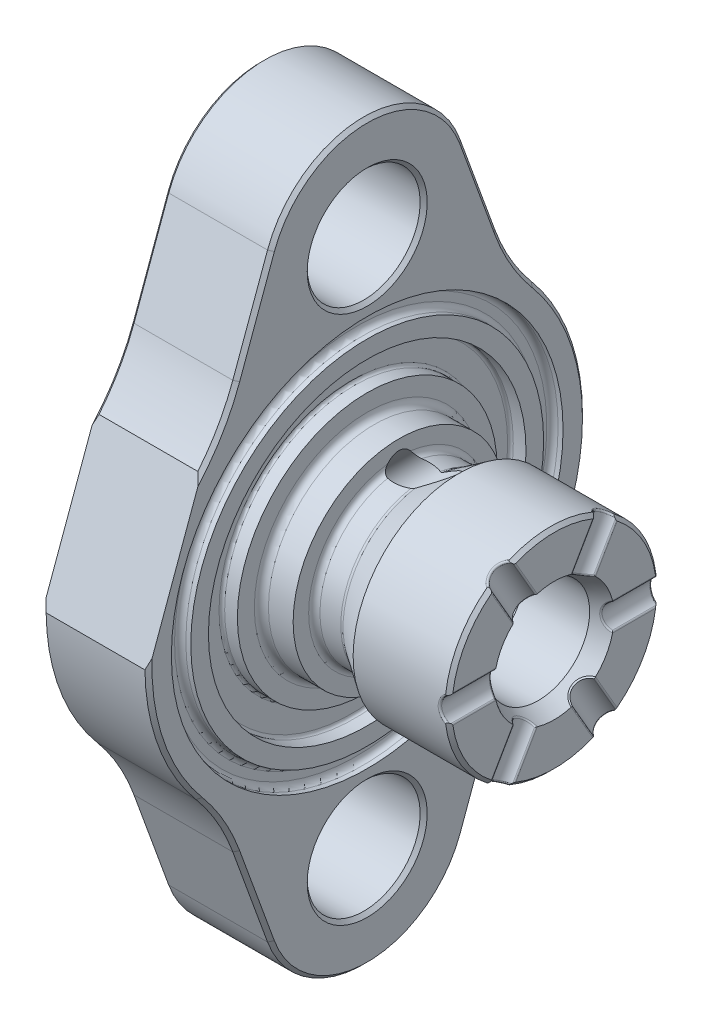
from build123d import *

# Parameters (mm, degrees)
SKETCH2_OUTSIDE_W  = 137.836
SKETCH2_OUTSIDE_H  = 137.836
CUT_EXTRUDE1_DEPTH = 86.05733360504549
SKETCH3_R          = 8
CUT_EXTRUDE2_DEPTH = 74.39788825300084
CHAMFER2_SIZE      = 0.5
CUT_EXTRUDE4_DEPTH = 74.39788825300084
CIRPATTERN1_COUNT  = 6
CUT_EXTRUDE5_DEPTH = 15
CUT_EXTRUDE6_START = -12
SKETCH10_R         = 2.5000000000000013
CUT_EXTRUDE6_DEPTH = 92.37332678519904
CIRPATTERN2_COUNT  = 2
SKETCH13_W         = 0.35897435897435903
SKETCH13_H         = 1.3461538461538485
SKETCH13_W_2       = 0.3589743589743595
SKETCH13_H_2       = 1.3461538461538463
EXTRUDE1_DEPTH     = 0.1
CHAMFER3_SIZE      = 0.5
FILLET1_R          = 0.25


with BuildPart() as part:
    # Sketch1 → Revolve1 (revolve)
    with BuildSketch(Plane.XY, mode=Mode.PRIVATE) as revolve1_sk:
        with BuildLine():
            Line((0, 0), (0, 52.5))
            Line((0, 52.5), (15, 52.5))
            Line((15, 52.5), (15.000000000000004, 27.75))
            Line((15.000000000000004, 27.75), (14.300000000000004, 27.749999999999996))
            ThreePointArc((14.300000000000004, 27.749999999999996), (13.734314575050764, 27.515685424949243), (13.500000000000002, 26.950000000000003))
            Line((13.500000000000002, 26.950000000000003), (13.500000000000002, 25.8))
            ThreePointArc((13.500000000000002, 25.8), (13.734314575050764, 25.23431457505076), (14.300000000000004, 24.999999999999996))
            Line((14.300000000000004, 24.999999999999996), (15.000000000000004, 25))
            Line((15.000000000000004, 25), (15.000000000000004, 22.5))
            Line((15.000000000000004, 22.5), (13.200000000000003, 22.500000000000004))
            ThreePointArc((13.200000000000003, 22.500000000000004), (12.917157287525379, 22.38284271247462), (12.800000000000004, 22.099999999999998))
            Line((12.800000000000004, 22.099999999999998), (12.800000000000004, 18.8))
            ThreePointArc((12.800000000000004, 18.8), (12.917157287525379, 18.51715728752538), (13.200000000000003, 18.399999999999995))
            Line((13.200000000000003, 18.399999999999995), (15.000000000000004, 18.4))
            Line((15.000000000000004, 18.4), (15.000000000000005, 15.997500000000008))
            ThreePointArc((15.000000000000005, 15.997500000000008), (15.292893218813456, 15.290393218813453), (16.00000000000001, 14.9975))
            Line((16.00000000000001, 14.9975), (19.500000000000004, 14.9975))
            Line((19.500000000000004, 14.9975), (19.499999999999996, 12.8))
            ThreePointArc((19.499999999999996, 12.8), (19.734314575050753, 12.23431457505076), (20.299999999999994, 11.999999999999998))
            Line((20.299999999999994, 11.999999999999998), (23.257947472805416, 12))
            ThreePointArc((23.257947472805416, 12), (23.489627504783442, 12.034281799365681), (23.701451515828207, 12.13418909304335))
            Line((23.701451515828207, 12.13418909304335), (28.000000000000004, 14.9975))
            Line((28.000000000000004, 14.9975), (41.5, 14.9975))
            Line((41.5, 14.9975), (41.5, 8.5))
            Line((41.5, 8.5), (39.25, 7.265))
            Line((39.25, 7.265), (29.999999999999996, 7.264999999999999))
            Line((29.999999999999996, 7.264999999999999), (29.999999999999996, 7.5))
            Line((29.999999999999996, 7.5), (28.499999999999996, 7.5))
            Line((28.499999999999996, 7.5), (27.908152290257846, 6.515))
            Line((27.908152290257846, 6.515), (13.499999999999996, 6.514999999999998))
            Line((13.499999999999996, 6.514999999999998), (13.500000000000004, 6.9))
            Line((13.500000000000004, 6.9), (11.500000000000005, 6.8999999999999995))
            Line((11.500000000000005, 6.8999999999999995), (7.354061728709797, 5e-17))
            Line((7.354061728709797, 5e-17), (0, 0))
        make_face()
    revolve(revolve1_sk.sketch.rotate(Axis((0, 0, 0), (1, 0, 0)), 90), axis=Axis((0, 0, 0), (1, 0, 0)))

    # Sketch2 outside → Cut-Extrude1 (cut, through all)
    with BuildSketch(Plane.ZY):
        Rectangle(SKETCH2_OUTSIDE_W, SKETCH2_OUTSIDE_H)
        with BuildLine():
            Line((13.6255430013957, 42.45929207822211), (18.546401412865883, 28.939344708374172))
            ThreePointArc((18.546401412865883, 28.939344708374172), (20.75479793540391, 24.2027552587924), (23.751681657864584, 19.92128556151584))
            ThreePointArc((23.751681657864584, 19.92128556151584), (31.000000000000007, 0), (23.751681657864584, -19.92128556151584))
            ThreePointArc((23.751681657864584, -19.92128556151584), (20.75479793540391, -24.2027552587924), (18.546401412865883, -28.939344708374172))
            Line((18.546401412865883, -28.939344708374172), (13.6255430013957, -42.45929207822211))
            ThreePointArc((13.6255430013957, -42.45929207822211), (8.9e-16, -52), (-13.6255430013957, -42.45929207822211))
            Line((-13.6255430013957, -42.45929207822211), (-18.546401412865883, -28.939344708374172))
            ThreePointArc((-18.546401412865883, -28.939344708374172), (-20.754797935403904, -24.20275525879241), (-23.751681657864584, -19.92128556151584))
            ThreePointArc((-23.751681657864584, -19.92128556151584), (-31.000000000000007, -3.8e-15), (-23.751681657864584, 19.92128556151584))
            ThreePointArc((-23.751681657864584, 19.92128556151584), (-20.754797935403904, 24.20275525879241), (-18.546401412865883, 28.939344708374172))
            Line((-18.546401412865883, 28.939344708374172), (-13.6255430013957, 42.45929207822211))
            ThreePointArc((-13.6255430013957, 42.45929207822211), (8.9e-16, 52), (13.6255430013957, 42.45929207822211))
        make_face(mode=Mode.SUBTRACT)
    extrude(amount=-CUT_EXTRUDE1_DEPTH, mode=Mode.SUBTRACT)

    # Sketch3 → Cut-Extrude2 (cut, through all)
    with BuildSketch(Plane.ZY):
        with Locations((0, 37.5)):
            Circle(SKETCH3_R)
    cut_extrude2 = extrude(amount=-CUT_EXTRUDE2_DEPTH, mode=Mode.SUBTRACT)

    # Mirror1: Cut-Extrude2 across plane
    add(cut_extrude2.mirror(Plane.ZX), mode=Mode.SUBTRACT)

    # Chamfer2
    chamfer2_edges = [part.edges().sort_by_distance(p)[0] for p in [
        (41.5, -3.5e-15, -14.9975),
    ]]
    chamfer(chamfer2_edges, length=CHAMFER2_SIZE)

    # Sketch8 → Cut-Extrude4 (cut, through all)
    with BuildSketch(Plane.XY):
        with BuildLine():
            Line((41.5, 1.833030277982335), (44.86569475313661, 1.833030277982335))
            Line((44.86569475313661, 1.833030277982335), (44.86569475313661, -1.833030277982335))
            Line((44.86569475313661, -1.833030277982335), (41.5, -1.833030277982335))
            ThreePointArc((41.5, -1.833030277982335), (40.300000000000004, 2.4e-16), (41.5, 1.833030277982335))
        make_face()
    cut_extrude4 = extrude(amount=-CUT_EXTRUDE4_DEPTH, mode=Mode.SUBTRACT)

    # CirPattern1: Cut-Extrude4 ×6 about axis
    cirpattern1_axis = Axis((29.999999999999993, 0, 0), (1, 0, 0))
    for i in range(1, CIRPATTERN1_COUNT):
        add(cut_extrude4.rotate(cirpattern1_axis, i * 360 / CIRPATTERN1_COUNT), mode=Mode.SUBTRACT)

    # Sketch9 → Cut-Extrude5 (cut)
    with BuildSketch(Plane.ZY):
        Polygon((12.584259431687194, 50.21535897561047), (38.15234714050532, -20.032384663003203), (42.19870201774117, -18.55963193041149), (16.630614308923015, 51.68811170820217), align=None)
    extrude(amount=-CUT_EXTRUDE5_DEPTH, mode=Mode.SUBTRACT)

    # Sketch10 → Cut-Extrude6 (cut)
    with BuildSketch(Plane(origin=(16.750000000000053, 16.749999999999986, 0), x_dir=(0, 0, -1), z_dir=(0.707106781186549, 0.7071067811865462, 0)).offset(CUT_EXTRUDE6_START)):
        with Locations(Location((0, -6.717514421272161, 0), (0, 0, 129.940308062))):
            Circle(SKETCH10_R)
    cut_extrude6 = extrude(amount=CUT_EXTRUDE6_DEPTH, mode=Mode.SUBTRACT)

    # CirPattern2: Cut-Extrude6 ×2 about axis
    cirpattern2_axis = Axis((29.999999999999993, 0, 0), (1, 0, 0))
    for i in range(1, CIRPATTERN2_COUNT):
        add(cut_extrude6.rotate(cirpattern2_axis, i * 360 / CIRPATTERN2_COUNT), mode=Mode.SUBTRACT)

    # Sketch13 → Extrude1 (cut)
    # profile 1 of 21: a face of its own
    with BuildSketch(Plane.ZY):
        Polygon((3.5, 17.327224246132346), (3.5, 15.173378092286192), (-0.08974358974358974, 17.013121682029784), (0.05959535256410257, 17.284455816645167), (3.1410256410256414, 15.70482841279901), (3.1410256410256414, 17.327224246132346), align=None)
    # profile 2 of 21: a face of its own
    with BuildSketch(Plane.ZY):
        with BuildLine():
            Line((2.6923076923076925, 14.41055757946568), (2.6923076923076925, 14.724660143568244))
            add(Edge.make_bspline(
                [(2.6923076923076925, 14.724660143568244), (2.727540176283071, 14.716150592887246), (2.7964168006737267, 14.699515117330144), (2.8948240615210463, 14.664817543861243), (2.987947582911763, 14.627018288666637), (3.074043656607156, 14.581629184101873), (3.154842559339845, 14.53212042987576), (3.2285116838079757, 14.475397708339884), (3.2969246492751014, 14.414077985773961), (3.357637886832305, 14.346253036472188), (3.4126156160390058, 14.275124374831382), (3.4594906733813775, 14.19968975508066), (3.4998148262458617, 14.121466861410049), (3.5330350581212375, 14.039913728461455), (3.558060581787342, 13.954787556769455), (3.57621738737812, 13.86685793344865), (3.5880085015925633, 13.775894433334), (3.5891592646789228, 13.714146842735733), (3.5897435897435903, 13.682793156388756)],
                knots=[0, 0, 0, 0, 1.1620055373349698, 2.271625781219752, 3.3437588547030215, 4.383309925831119, 5.39022955834945, 6.379919255913445, 7.361854164461791, 8.333198761440462, 9.295911338119772, 10.242430841623444, 11.177959212100072, 12.116337294834628, 13.062827104074566, 14.020064771255525, 14.994644689000603, 16, 16, 16, 16], degree=3))
            add(Edge.make_bspline(
                [(3.5897435897435903, 13.682793156388756), (3.588364359498635, 13.63711041431368), (3.585635984023821, 13.546741403370213), (3.5607215475447385, 13.41397835641972), (3.5212964151905446, 13.285951537317603), (3.466822688053536, 13.164062289501269), (3.399635374891451, 13.050843856904997), (3.319670637996682, 12.950107670157891), (3.2284713365093323, 12.863219159353934), (3.1277387721907592, 12.790324781693814), (3.020083262803815, 12.733249782640124), (2.9092831056565314, 12.691163409160414), (2.795601134267613, 12.665541728161752), (2.7188438550924405, 12.662221171351522), (2.680388621794872, 12.66055757946568)],
                knots=[0, 0, 0, 0, 1.0830509921121227, 2.14247749834422, 3.1931164062458444, 4.255571735486082, 5.3026338402067585, 6.308962981963783, 7.297363603243642, 8.282367273934597, 9.249857811964022, 10.17991417506493, 11.08814088029692, 12, 12, 12, 12], degree=3))
            add(Edge.make_bspline(
                [(2.680388621794872, 12.66055757946568), (2.643381827089281, 12.661721170512743), (2.570965272626188, 12.663998137623864), (2.4652437754880023, 12.683331843186199), (2.365602175205802, 12.715868106062429), (2.271621013082324, 12.760937868640292), (2.183896173259215, 12.819279418880571), (2.102230282398709, 12.889952115770893), (2.0262611242704605, 12.973454777546383), (1.9827416512949776, 13.036733715569676), (1.9603365384615383, 13.069311585875937)],
                knots=[0, 0, 0, 0, 1.0245403887671216, 2.0048665509413475, 2.965041327316024, 3.9205779738395923, 4.882998113236959, 5.8745045592922045, 6.905732033959908, 8, 8, 8, 8], degree=3))
            add(Edge.make_bspline(
                [(1.9603365384615383, 13.069311585875937), (1.9423583669200504, 13.032079831302601), (1.906738409309856, 12.95831295703539), (1.836882651792614, 12.857762427502491), (1.7562263044387219, 12.76648455214553), (1.6932836515251508, 12.71558083314173), (1.661658653846154, 12.690004694850295)],
                knots=[0, 0, 0, 0, 1.0155184013066223, 2.012035669113458, 3.001164322759901, 4, 4, 4, 4], degree=3))
            add(Edge.make_bspline(
                [(1.661658653846154, 12.690004694850295), (1.6386033595211467, 12.673156497079333), (1.5928703172789336, 12.639736002441413), (1.519297991959235, 12.598600622225582), (1.4451537604097204, 12.560856138243038), (1.367522367074115, 12.533077290619465), (1.2888974696262363, 12.509105245930657), (1.20759539477244, 12.493332438735203), (1.1243885810414418, 12.48320692742858), (1.0680718758204446, 12.481785098837182), (1.0397636217948718, 12.4810703999785)],
                knots=[0, 0, 0, 0, 1.02516403999572, 2.033540309024338, 3.0251291177087105, 4.011046664595244, 4.99165582755763, 5.976607086618634, 6.982917761954089, 8, 8, 8, 8], degree=3))
            add(Edge.make_bspline(
                [(1.0397636217948718, 12.4810703999785), (0.9907558494537949, 12.482868864972028), (0.8929709361311208, 12.486457331354094), (0.7484669820315669, 12.518402133994547), (0.6074562425529441, 12.568210877361729), (0.4720280383946274, 12.637706745996056), (0.3455814608888269, 12.7236913915719), (0.23295943147021994, 12.826554397830499), (0.13550051689308096, 12.943795181496512), (0.05433386896113747, 13.074646425028494), (-0.01059594721926829, 13.216351109707853), (-0.05565015372186825, 13.367930087653818), (-0.08499703498658243, 13.527179219272325), (-0.0881437822544799, 13.63638664406919), (-0.08974358974358974, 13.691907739722089)],
                knots=[0, 0, 0, 0, 0.9557004503398928, 1.9069033590942746, 2.875197579821409, 3.868912785844181, 4.869932978082157, 5.851730567403769, 6.836639975686772, 7.8367759799723276, 8.849487602079678, 9.869908895446951, 10.917060884960387, 12, 12, 12, 12], degree=3))
            add(Edge.make_bspline(
                [(-0.08974358974358974, 13.691907739722089), (-0.0888753764850976, 13.729327040005222), (-0.08716702230787451, 13.802955745075307), (-0.0754884211112882, 13.911199243461633), (-0.05415841587348696, 14.014520942826143), (-0.02545511050739394, 14.113060540682824), (0.01093663157310268, 14.206905577076373), (0.05625532959442686, 14.295769682254083), (0.10956683164625503, 14.380199575774185), (0.17150041945281883, 14.45939852691876), (0.2407817592095762, 14.533357094624996), (0.31864076917726347, 14.600109818855126), (0.40363817309830846, 14.660769611797216), (0.4967612292970411, 14.713712250508719), (0.5968064865748067, 14.761349203124569), (0.705054984956456, 14.800530159771872), (0.8205390069454509, 14.835015728408164), (0.9010167471212932, 14.851049192654244), (0.9423076923076924, 14.859275528183629)],
                knots=[0, 0, 0, 0, 1.0486587253984627, 2.063410684521507, 3.046034179016975, 4.001477786704841, 4.9367749193472275, 5.862367408884741, 6.79267502826689, 7.73071994276649, 8.675894397297922, 9.627829632277287, 10.600096035993712, 11.597688215181552, 12.626045268498899, 13.70154239805616, 14.820723759790488, 16, 16, 16, 16], degree=3))
            Line((0.9423076923076924, 14.859275528183629), (0.9423076923076924, 14.545172964081063))
            add(Edge.make_bspline(
                [(0.9423076923076924, 14.545172964081063), (0.9153586790390535, 14.536989672640786), (0.8629405074209449, 14.521072459982882), (0.7875002017460693, 14.493978161947778), (0.7183421485212713, 14.463109889877316), (0.6549590265432946, 14.429995331241262), (0.5967266240791098, 14.395216885218522), (0.5451847550450323, 14.356301960082117), (0.4980695528352466, 14.316132814934807), (0.4715249408950387, 14.285853461583471), (0.45853365384615385, 14.271034342286192)],
                knots=[0, 0, 0, 0, 1.198163088255743, 2.3305312799619577, 3.407730984837941, 4.417276591756229, 5.372219308188746, 6.288973029533279, 7.162600584563567, 8, 8, 8, 8], degree=3))
            add(Edge.make_bspline(
                [(0.45853365384615385, 14.271034342286192), (0.44342531996064316, 14.25143776576104), (0.4132552881761638, 14.212305102880334), (0.3747536596383947, 14.148536871781893), (0.3413926343036346, 14.081471985696169), (0.31590893858733377, 14.009657311475268), (0.2943312777981666, 13.934642541021223), (0.28021075866568323, 13.855215175789402), (0.27052258732247825, 13.772075958677654), (0.2696676558300899, 13.71530819519459), (0.2692307692307692, 13.686298765363116)],
                knots=[0, 0, 0, 0, 0.9461704386858175, 1.8894202646701022, 2.8453034635880767, 3.8072333173654624, 4.8010187336886645, 5.828864929240964, 6.890507805391561, 7.999999999999999, 7.999999999999999, 7.999999999999999, 7.999999999999999], degree=3))
            add(Edge.make_bspline(
                [(0.2692307692307692, 13.686298765363116), (0.2698456728190377, 13.653544819346267), (0.2710480637031368, 13.589497305459044), (0.2821377647568464, 13.496048640443759), (0.298218176717238, 13.407119060508968), (0.32337106756199, 13.323616091748443), (0.3535461153188581, 13.244403463669869), (0.3930507909551682, 13.171249430983714), (0.4376649354386347, 13.102003355509135), (0.4895597661092061, 13.03869382723577), (0.5456524608668835, 12.981617191837067), (0.605161811145148, 12.932296672680549), (0.6662426398186708, 12.889579462332295), (0.7303198391555061, 12.855241954043262), (0.7967648633416183, 12.828079373337403), (0.8658264166910409, 12.809599384110605), (0.9369229577120576, 12.796747014060898), (0.9852520248140252, 12.795700517605383), (1.0096153846153846, 12.795172964081063)],
                knots=[0, 0, 0, 0, 1.2169902490053657, 2.379719372856595, 3.4939923959035655, 4.5715614974838354, 5.6169231069193195, 6.638958651669118, 7.655775068385381, 8.674704564499468, 9.676001864690218, 10.625896027681804, 11.543994809758585, 12.441854662164076, 13.322657739160784, 14.205728449817185, 15.095482574364297, 16, 16, 16, 16], degree=3))
            add(Edge.make_bspline(
                [(1.0096153846153846, 12.795172964081063), (1.0422267603413182, 12.796703238432778), (1.1072872421297413, 12.799756172704168), (1.2030042643698267, 12.823065159162658), (1.2952298299045064, 12.861402435878768), (1.3823771843806254, 12.915081166796385), (1.4631853430830422, 12.98039311202129), (1.5350039873149828, 13.056706055642998), (1.5948606858297907, 13.144207193116939), (1.6360637923798793, 13.225259869214597), (1.6635239301331084, 13.297226873309562), (1.6827784646513568, 13.358692412601155), (1.6981701983606206, 13.427565828651169), (1.7130586400491385, 13.503020311103864), (1.7255401647413753, 13.585374088892118), (1.7359939308830126, 13.674701357575552), (1.7443454461857744, 13.771038054195117), (1.7480770466325624, 13.837729086081549), (1.75, 13.872096041004141)],
                knots=[0, 0, 0, 0, 1.0704819572377842, 2.1356373453549167, 3.2163665289220638, 4.33948589487598, 5.4857465865183705, 6.620975969003476, 7.768829582245531, 8.956804398720841, 9.598399438457253, 10.297751078364724, 11.070570279209045, 11.915248466491033, 12.824061283657528, 13.805856426131124, 14.869322738546588, 16, 16, 16, 16], degree=3))
            Line((1.75, 13.872096041004141), (2.108974358974359, 13.872096041004141))
            add(Edge.make_bspline(
                [(2.108974358974359, 13.872096041004141), (2.109712366567757, 13.828796072095749), (2.1111579421489926, 13.743982069798038), (2.12852085207373, 13.620070917681268), (2.1528092789867666, 13.501440635207468), (2.189153679483556, 13.390799092366256), (2.2327773334502177, 13.290282083470318), (2.2819661890696232, 13.202596734313303), (2.337694955498212, 13.129821153368404), (2.3992322461107105, 13.071773517331703), (2.466002421357568, 13.029168613610555), (2.5348659185328013, 12.997189413547892), (2.607424962670785, 12.978441910758008), (2.6569149467292696, 12.975925171350505), (2.6817908653846154, 12.974660143568244)],
                knots=[0, 0, 0, 0, 1.3217085786038163, 2.58890242299633, 3.815526511670777, 5.016621128178275, 6.138757764426388, 7.158873101332162, 8.079948562841965, 8.928590312686318, 9.7286018676034, 10.489025425318621, 11.240515402760044, 12, 12, 12, 12], degree=3))
            add(Edge.make_bspline(
                [(2.6817908653846154, 12.974660143568244), (2.7000686544675108, 12.9750745062851), (2.7364314489800825, 12.975898861258148), (2.789555872909323, 12.98629684696311), (2.841059225672671, 13.001918245328401), (2.8907078156581707, 13.023408098146351), (2.9382134593551905, 13.052119462133092), (2.983634436884793, 13.08658266354188), (3.0277319567925467, 13.12681433610762), (3.068396339767633, 13.173865933612769), (3.106753266049867, 13.224804306069712), (3.1399114019628587, 13.280108751498908), (3.1680162158036085, 13.338559462847499), (3.19123678326708, 13.40021018970387), (3.2086930247942966, 13.465307902882621), (3.2212297197195943, 13.533533849017719), (3.229067136938206, 13.605021702701002), (3.230195585748459, 13.653793411134963), (3.2307692307692313, 13.678586425619525)],
                knots=[0, 0, 0, 0, 0.8843172719891974, 1.7593072717615015, 2.6117360648808896, 3.488921042597716, 4.372440619562797, 5.294096727927958, 6.247679002977407, 7.258495568618276, 8.302441961635706, 9.333537773143622, 10.376747089303088, 11.440883504551861, 12.52033030080086, 13.637364710823222, 14.798958395611331, 16, 16, 16, 16], degree=3))
            add(Edge.make_bspline(
                [(3.2307692307692313, 13.678586425619525), (3.2293805676244074, 13.718439410551808), (3.2266681855246575, 13.796281559207417), (3.202827569470958, 13.90847812762428), (3.1650545709639397, 14.01267235535873), (3.119443787299777, 14.092047338874709), (3.074574995119947, 14.15076008338855), (3.035974373276821, 14.19352005468656), (2.9922091742347114, 14.234745047172218), (2.9420789678386106, 14.272817354753558), (2.8873075289889925, 14.310018350722903), (2.8275931969946226, 14.345992821176196), (2.7620846241916115, 14.379585265289624), (2.7160171076453112, 14.400033536047017), (2.6923076923076925, 14.41055757946568)],
                knots=[0, 0, 0, 0, 1.4727371997174743, 2.8765982830607153, 4.222346150642963, 5.558423781638689, 6.243133849849978, 6.953189256367999, 7.687156129903641, 8.463578749056241, 9.278833270901439, 10.135787152083797, 11.040551781328434, 12, 12, 12, 12], degree=3))
        make_face()
    # profile 3 of 21: a face of its own
    with BuildSketch(Plane.ZY):
        Polygon((3.5, 11.942608861516959), (3.5, 9.788762707670806), (-0.08974358974358974, 11.628506297414393), (0.05959535256410257, 11.899840432029778), (3.1410256410256414, 10.320213028183625), (3.1410256410256414, 11.942608861516959), align=None)
    # profile 4 of 21: a face of its own
    with BuildSketch(Plane.ZY):
        with BuildLine():
            Line((2.4230769230769234, 9.025942194850295), (2.4230769230769234, 9.340044758952857))
            add(Edge.make_bspline(
                [(2.4230769230769234, 9.340044758952857), (2.4647480162552986, 9.337997954396865), (2.5465889342511123, 9.333978084721183), (2.6659099340963426, 9.315144864874418), (2.7799752522901455, 9.288221832560284), (2.8878069883376085, 9.250065614739052), (2.9906932827952453, 9.202946020098436), (3.0872679246917514, 9.145258000371374), (3.1784894058978006, 9.078231370706622), (3.2626306012624657, 9.001989094131797), (3.3395461738893233, 8.919259197268312), (3.4066695885354368, 8.830537360818806), (3.4627334399007257, 8.736735477584732), (3.509856399944955, 8.638667144937191), (3.545184955334318, 8.535198173653518), (3.5714096774867716, 8.427317611295775), (3.587185182412012, 8.314537848770314), (3.588881084067593, 8.237697913143323), (3.5897435897435903, 8.198618476901578)],
                knots=[0, 0, 0, 0, 1.1007762679238446, 2.161895294881408, 3.184016181880073, 4.190939212431858, 5.17650055109085, 6.166955529064783, 7.155448255761951, 8.160289652533228, 9.160174559868716, 10.13382435614162, 11.09146764388835, 12.040886210096515, 13.000931625186727, 13.972173743445799, 14.968683325204282, 16, 16, 16, 16], degree=3))
            add(Edge.make_bspline(
                [(3.5897435897435903, 8.198618476901578), (3.5888451332981623, 8.160240402814233), (3.5870796984771744, 8.084828858157824), (3.571918669209945, 7.974766843704937), (3.5481730775746554, 7.869989549241552), (3.514857661261359, 7.770701782719653), (3.4700732338688307, 7.677695718148403), (3.4162756952106816, 7.590272673592054), (3.3540558638385143, 7.507391862801054), (3.280802050390125, 7.432785079188893), (3.2025996659197618, 7.364276999952637), (3.119111762307611, 7.305174744808362), (3.0328824765925932, 7.254561581335036), (2.943254275011082, 7.212373901453856), (2.8493832465983897, 7.181317762514727), (2.752636043806743, 7.157739554485356), (2.6520112328001795, 7.144412140797264), (2.5839046771524345, 7.142366717299414), (2.5492788461538467, 7.14132681023491)],
                knots=[0, 0, 0, 0, 1.1116073639947277, 2.1842687618847845, 3.2126211777481752, 4.221274765693222, 5.2117603674467246, 6.19665107544466, 7.192147500201651, 8.207485112727067, 9.220403447888982, 10.20128160422279, 11.166441694673637, 12.114753414831767, 13.065576455818489, 14.026450734285117, 14.996634278563844, 16, 16, 16, 16], degree=3))
            add(Edge.make_bspline(
                [(2.5492788461538467, 7.14132681023491), (2.50053101157902, 7.143020073091391), (2.4038907979084962, 7.146376884438561), (2.2618759351593107, 7.175091261005977), (2.1242825160726357, 7.219937772101431), (2.0135452139881904, 7.273935128950778), (1.9243117202311597, 7.328407573012459), (1.8508430153114157, 7.377495080606103), (1.7717375469220178, 7.434959891627912), (1.6872602095480647, 7.501638389590599), (1.5967493044495056, 7.576151261741336), (1.5002595090510964, 7.659173425097971), (1.3987877392310442, 7.75129690711937), (1.3294821378432156, 7.81595540787371), (1.2935697115384617, 7.8494598230554224)],
                knots=[0, 0, 0, 0, 1.1844263556738324, 2.3480677057279706, 3.5090691180954496, 4.696110525597899, 5.333549288062708, 6.050745305391794, 6.84422805593614, 7.710549037172976, 8.667450064128223, 9.695053472192544, 10.805634455820183, 12, 12, 12, 12], degree=3))
            Line((1.2935697115384617, 7.8494598230554224), (0.358974358974359, 8.725160944850295))
            Line((0.358974358974359, 8.725160944850295), (0.358974358974359, 7.096455015363115))
            Line((0.358974358974359, 7.096455015363115), (0, 7.096455015363115))
            Line((0, 7.096455015363115), (0, 9.474660143568244))
            Line((0, 9.474660143568244), (1.4485176282051282, 8.117288348696446))
            add(Edge.make_bspline(
                [(1.4485176282051282, 8.117288348696446), (1.4830140531509, 8.084238122127436), (1.5492746255811305, 8.020755400806195), (1.6460423409824398, 7.931003607014394), (1.7357096768718423, 7.850262397478119), (1.8186739705053592, 7.778478212988072), (1.894464891905094, 7.715591989011296), (1.9636763966503954, 7.661804933869736), (2.025714531808434, 7.616879318480763), (2.098594338985938, 7.569267528031589), (2.1876818693221587, 7.523866526426767), (2.2960038637640494, 7.4839636915709224), (2.407759456975082, 7.459807058225946), (2.483257707236416, 7.456894444174822), (2.5212339743589745, 7.4554293743374735)],
                knots=[0, 0, 0, 0, 1.3295300818459475, 2.553755191293282, 3.6729349187011793, 4.687409496722565, 5.606792720374879, 6.413407420580361, 7.1264016179861995, 7.7379956235912495, 8.834647425602135, 9.900448820001378, 10.94390775715839, 12, 12, 12, 12], degree=3))
            add(Edge.make_bspline(
                [(2.5212339743589745, 7.4554293743374735), (2.5451180117736394, 7.456058586310215), (2.5921888631047785, 7.4572986422819305), (2.6611567571572996, 7.4684500382361625), (2.727942287819613, 7.484833652202947), (2.791719699866411, 7.510085862435103), (2.8537433717080636, 7.540425463246299), (2.9121275902869788, 7.579186540569695), (2.968862533484964, 7.623480273333228), (3.0220028071234486, 7.674858830734883), (3.0706875495466126, 7.731262940131535), (3.1138107111594517, 7.790859125216565), (3.149850063069385, 7.8539087243133014), (3.179393495660546, 7.9201489818131225), (3.2025688944123116, 7.989394414440279), (3.2186274690772776, 8.061779169531682), (3.2287099543260434, 8.13710318308603), (3.2300741260538186, 8.188536679155034), (3.2307692307692313, 8.214744278183627)],
                knots=[0, 0, 0, 0, 0.9915046270679794, 1.9540652229173734, 2.89598598706654, 3.842598664717615, 4.79783556396626, 5.7592202734813025, 6.747868630085254, 7.784730864198361, 8.824135543897013, 9.83991899574408, 10.835834653239022, 11.835434875862815, 12.848616609510303, 13.86379668533038, 14.911511676373332, 15.999999999999998, 15.999999999999998, 15.999999999999998, 15.999999999999998], degree=3))
            add(Edge.make_bspline(
                [(3.2307692307692313, 8.214744278183627), (3.2300544147714514, 8.24211523243139), (3.228650634178102, 8.295867267240073), (3.2188249021257453, 8.374784576638016), (3.2018902290800115, 8.450076627624176), (3.1786731511687996, 8.521895833163793), (3.1494426660167156, 8.590311390060522), (3.112332364296849, 8.654704685092552), (3.068791169063379, 8.715663607688663), (3.0191565832950182, 8.77307619826942), (2.963634416537211, 8.825829360997892), (2.902503649392095, 8.873153234357655), (2.8353666339107724, 8.913515495806465), (2.763739792308311, 8.94929482399482), (2.685718656510805, 8.97667130536199), (2.6031938577205627, 9.000072458172221), (2.514992916176466, 9.017071665420312), (2.4542244645499753, 9.022936241544551), (2.4230769230769234, 9.025942194850295)],
                knots=[0, 0, 0, 0, 1.0312128646320886, 2.025131798223496, 2.9907574456033177, 3.9347812663878035, 4.8655700669486945, 5.78849479099787, 6.7292273132744205, 7.684356717974949, 8.643577151762196, 9.610526866261523, 10.590658432171658, 11.590954189844334, 12.621640560874933, 13.700587263338269, 14.821410589510345, 16, 16, 16, 16], degree=3))
        make_face()
    # profile 5 of 21: a face of its own
    with BuildSketch(Plane.ZY):
        with BuildLine():
            Line((2.4230769230769234, 4.987480656388756), (2.4230769230769234, 5.301583220491321))
            add(Edge.make_bspline(
                [(2.4230769230769234, 5.301583220491321), (2.4647480162552986, 5.299536415935329), (2.5465889342511123, 5.295516546259643), (2.6659099340963426, 5.2766833264128765), (2.7799752522901455, 5.249760294098746), (2.887806988337609, 5.211604076277514), (2.9906932827952453, 5.1644844816368956), (3.0872679246917514, 5.1067964619098385), (3.1784894058978006, 5.039769832245081), (3.2626306012624653, 4.963527555670257), (3.3395461738893237, 4.880797658806775), (3.406669588535437, 4.792075822357269), (3.4627334399007244, 4.6982739391231965), (3.5098563999449555, 4.6002056064756545), (3.5451849553343173, 4.496736635191979), (3.5714096774867725, 4.388856072834237), (3.587185182412012, 4.276076310308778), (3.588881084067593, 4.199236374681785), (3.5897435897435903, 4.160156938440038)],
                knots=[0, 0, 0, 0, 1.1007762679238446, 2.161895294881407, 3.184016181880071, 4.190939212431853, 5.176500551090845, 6.166955529064777, 7.15544825576195, 8.16028965253323, 9.160174559868713, 10.133824356141616, 11.091467643888354, 12.04088621009651, 13.00093162518672, 13.972173743445785, 14.968683325204275, 16, 16, 16, 16], degree=3))
            add(Edge.make_bspline(
                [(3.5897435897435903, 4.160156938440038), (3.5888451332981623, 4.121778864352696), (3.587079698477174, 4.046367319696284), (3.571918669209945, 3.9363053052433985), (3.5481730775746554, 3.831528010780015), (3.514857661261359, 3.7322402442581155), (3.4700732338688307, 3.6392341796868655), (3.4162756952106816, 3.5518111351305173), (3.354055863838514, 3.4689303243395173), (3.280802050390125, 3.3943235407273553), (3.2025996659197613, 3.325815461491101), (3.1191117623076114, 3.2667132063468243), (3.0328824765925924, 3.2161000428735), (2.943254275011082, 3.1739123629923194), (2.8493832465983897, 3.14285622405319), (2.752636043806743, 3.119278016023819), (2.6520112328001795, 3.1059506023357266), (2.5839046771524345, 3.103905178837876), (2.5492788461538467, 3.102865271773372)],
                knots=[0, 0, 0, 0, 1.11160736399472, 2.184268761884786, 3.212621177748177, 4.221274765693217, 5.211760367446719, 6.196651075444656, 7.192147500201644, 8.207485112727063, 9.220403447888975, 10.201281604222789, 11.166441694673631, 12.114753414831766, 13.065576455818489, 14.026450734285117, 14.996634278563844, 16, 16, 16, 16], degree=3))
            add(Edge.make_bspline(
                [(2.5492788461538467, 3.102865271773372), (2.50053101157902, 3.104558534629853), (2.4038907979084962, 3.1079153459770223), (2.2618759351593107, 3.1366297225444386), (2.1242825160726357, 3.1814762336398923), (2.013545213988191, 3.23547359048924), (1.9243117202311593, 3.289946034550921), (1.8508430153114164, 3.3390335421445667), (1.7717375469220173, 3.396498353166373), (1.6872602095480647, 3.4631768511290613), (1.5967493044495056, 3.537689723279798), (1.5002595090510966, 3.620711886636434), (1.398787739231044, 3.7128353686578315), (1.3294821378432156, 3.7774938694121714), (1.2935697115384617, 3.8109982845938846)],
                knots=[0, 0, 0, 0, 1.1844263556738324, 2.3480677057279697, 3.5090691180954496, 4.696110525597899, 5.333549288062706, 6.0507453053917954, 6.84422805593614, 7.710549037172976, 8.667450064128223, 9.695053472192544, 10.805634455820181, 12, 12, 12, 12], degree=3))
            Line((1.2935697115384617, 3.8109982845938846), (0.358974358974359, 4.686699406388756))
            Line((0.358974358974359, 4.686699406388756), (0.358974358974359, 3.057993476901577))
            Line((0.358974358974359, 3.057993476901577), (0, 3.057993476901577))
            Line((0, 3.057993476901577), (0, 5.436198605106705))
            Line((0, 5.436198605106705), (1.4485176282051282, 4.078826810234911))
            add(Edge.make_bspline(
                [(1.4485176282051282, 4.078826810234911), (1.4830140531509, 4.045776583665899), (1.5492746255811307, 3.982293862344657), (1.6460423409824396, 3.8925420685528564), (1.7357096768718423, 3.811800859016581), (1.8186739705053592, 3.7400166745265353), (1.894464891905094, 3.677130450549759), (1.9636763966503954, 3.6233433954081984), (2.025714531808434, 3.5784177800192256), (2.098594338985938, 3.530805989570052), (2.1876818693221587, 3.485404987965229), (2.2960038637640494, 3.4455021531093863), (2.407759456975082, 3.42134551976441), (2.483257707236416, 3.418432905713284), (2.5212339743589745, 3.416967835875936)],
                knots=[0, 0, 0, 0, 1.3295300818459472, 2.553755191293287, 3.6729349187011837, 4.6874094967225695, 5.606792720374884, 6.4134074205803655, 7.126401617986202, 7.73799562359125, 8.834647425602139, 9.900448820001378, 10.94390775715839, 11.999999999999998, 11.999999999999998, 11.999999999999998, 11.999999999999998], degree=3))
            add(Edge.make_bspline(
                [(2.5212339743589745, 3.416967835875936), (2.5451180117736394, 3.4175970478486777), (2.5921888631047785, 3.418837103820392), (2.6611567571573, 3.429988499774626), (2.727942287819613, 3.446372113741409), (2.791719699866411, 3.471624323973565), (2.8537433717080636, 3.5019639247847603), (2.9121275902869788, 3.540725002108157), (2.9688625334849648, 3.585018734871689), (3.0220028071234477, 3.6363972922733443), (3.0706875495466126, 3.6928014016699975), (3.1138107111594517, 3.752397586755029), (3.149850063069386, 3.8154471858517662), (3.179393495660545, 3.8816874433515847), (3.2025688944123116, 3.950932875978745), (3.218627469077278, 4.023317631070142), (3.2287099543260434, 4.098641644624491), (3.2300741260538186, 4.150075140693497), (3.2307692307692313, 4.17628273972209)],
                knots=[0, 0, 0, 0, 0.991504627067979, 1.9540652229173736, 2.89598598706654, 3.8425986647176122, 4.797835563966254, 5.7592202734813025, 6.74786863008525, 7.784730864198357, 8.82413554389701, 9.839918995744076, 10.835834653239017, 11.83543487586282, 12.848616609510309, 13.863796685330373, 14.91151167637332, 16, 16, 16, 16], degree=3))
            add(Edge.make_bspline(
                [(3.2307692307692313, 4.17628273972209), (3.2300544147714514, 4.203653693969853), (3.228650634178102, 4.257405728778535), (3.2188249021257453, 4.336323038176478), (3.2018902290800115, 4.411615089162638), (3.178673151168799, 4.483434294702256), (3.149442666016716, 4.551849851598985), (3.1123323642968495, 4.616243146631017), (3.0687911690633785, 4.677202069227125), (3.0191565832950182, 4.734614659807882), (2.963634416537211, 4.787367822536357), (2.902503649392095, 4.834691695896119), (2.8353666339107724, 4.8750539573449245), (2.763739792308311, 4.910833285533282), (2.685718656510805, 4.938209766900452), (2.6031938577205627, 4.961610919710685), (2.514992916176466, 4.978610126958775), (2.4542244645499753, 4.984474703083013), (2.4230769230769234, 4.987480656388756)],
                knots=[0, 0, 0, 0, 1.0312128646320675, 2.0251317982234864, 2.990757445603309, 3.934781266387785, 4.865570066948695, 5.788494790997872, 6.729227313274415, 7.684356717974944, 8.64357715176219, 9.610526866261518, 10.590658432171653, 11.590954189844334, 12.621640560874932, 13.700587263338269, 14.821410589510345, 16, 16, 16, 16], degree=3))
        make_face()
    # profile 6 of 21: a face of its own
    with BuildSketch(Plane.ZY):
        with BuildLine():
            Line((-0.08974358974358974, 1.9810703999784962), (0.08483573717948718, 2.2320720025425986))
            Line((0.08483573717948718, 2.2320720025425986), (1.507411858974359, 1.2589149512605473))
            add(Edge.make_bspline(
                [(1.507411858974359, 1.2589149512605473), (1.4998187956516664, 1.3210056868606357), (1.4848676306337896, 1.44326580699738), (1.4821209759152645, 1.5664029090690292), (1.4807692307692308, 1.6270038935682398)],
                knots=[0, 0, 0, 0, 1.0157152721695644, 2, 2, 2, 2], degree=3))
            add(Edge.make_bspline(
                [(1.4807692307692308, 1.6270038935682398), (1.4817130980724469, 1.663744925031809), (1.4835658270494712, 1.735864356869731), (1.4981679437316384, 1.8419104639261548), (1.520912447516324, 1.9439590956541237), (1.5540641164754543, 2.0416215465911467), (1.5964328198816977, 2.1348108158581773), (1.64804342827047, 2.2238520931095582), (1.709088051960137, 2.3086274766804737), (1.7789105199484403, 2.3881394183856486), (1.855591388998435, 2.4604499443788486), (1.9367463005231276, 2.5248735570972074), (2.02332246065662, 2.578414607474502), (2.1135526300344165, 2.6228912144498056), (2.2087339942655193, 2.656621662270472), (2.307783390749255, 2.6811842014360043), (2.4113950337288204, 2.696306555377612), (2.4819201643609086, 2.698105650968613), (2.517728365384616, 2.6990191179272145)],
                knots=[0, 0, 0, 0, 1.0607024938776999, 2.0820662393046363, 3.0857487334873386, 4.076089625288063, 5.054723784523065, 6.037561548492645, 7.043420247223245, 8.06692260342754, 9.088643094846992, 10.083733410130387, 11.053858765190817, 12.022809491711666, 12.983497605349196, 13.964038392851265, 14.966267458820386, 16, 16, 16, 16], degree=3))
            add(Edge.make_bspline(
                [(2.517728365384616, 2.6990191179272145), (2.566697018104521, 2.697284683142016), (2.6628125496748947, 2.6938803395039126), (2.8032463186763295, 2.6664818222435436), (2.936032862293876, 2.6214214830476426), (3.0608230562169196, 2.5585931062822342), (3.175821795436888, 2.479458384851878), (3.2794304045554092, 2.3843497946925285), (3.3701752584016784, 2.273845830405543), (3.448179335818053, 2.1504638112788346), (3.5109143330863466, 2.0171107905113335), (3.557153633573293, 1.8774421324336512), (3.58435238143949, 1.7325280123636864), (3.5879382425637214, 1.6343603422126747), (3.5897435897435903, 1.5849365858759321)],
                knots=[0, 0, 0, 0, 1.0229886121174763, 2.0079191234138585, 2.9781038949702117, 3.945948939739223, 4.918897163721234, 5.887013413689554, 6.87592184627268, 7.899178709856421, 8.930658927695882, 9.948724883896078, 10.967259573727405, 12, 12, 12, 12], degree=3))
            add(Edge.make_bspline(
                [(3.5897435897435903, 1.5849365858759321), (3.587920003292488, 1.536446276673197), (3.5843167683483528, 1.440633996171995), (3.5576960125034045, 1.2995533998016624), (3.513307657786779, 1.164308869651715), (3.451683932430054, 1.035964486071552), (3.373939388478443, 0.91774571496494), (3.282064283860577, 0.8110308988612225), (3.1750233932163847, 0.7186789409131555), (3.055744599587615, 0.6408485943815646), (2.9275750204387263, 0.5783802864674592), (2.7937917807782826, 0.5333075481468955), (2.6553528815624325, 0.5055620277944645), (2.5615584314683626, 0.5020656847033679), (2.5142227564102564, 0.5003011692092654)],
                knots=[0, 0, 0, 0, 1.0263373219364298, 2.0279458101017727, 3.02787825154735, 4.032696425262242, 5.033228651187491, 6.0154584944946095, 7.004668777062665, 8.016190508620454, 9.023163053337798, 10.015265300024215, 10.99835484146048, 12, 12, 12, 12], degree=3))
            add(Edge.make_bspline(
                [(2.5142227564102564, 0.5003011692092654), (2.4774760476349478, 0.5014650227674967), (2.402944540636152, 0.5038256085862511), (2.2898146173374956, 0.5207838741427638), (2.174225985050517, 0.5482497606624634), (2.0762625138826607, 0.5801090178750743), (1.9961737438725737, 0.6127329878619914), (1.9319004802151445, 0.6408016284439183), (1.8648262995660267, 0.673471379593218), (1.7954441706864128, 0.7122782582955886), (1.7219286557878752, 0.7528494426730011), (1.6458852460814233, 0.798979629491243), (1.5668890068347494, 0.8492649127427082), (1.513643505243626, 0.8850974944936764), (1.4863782051282053, 0.9034462012605473)],
                knots=[0, 0, 0, 0, 1.1796887111954304, 2.3927034655669956, 3.6650148101028868, 4.99156214359674, 5.695278944288936, 6.4412210781976, 7.2433289774127205, 8.089575748462757, 8.993388627338607, 9.939305498406055, 10.944784961110726, 12, 12, 12, 12], degree=3))
            Line((1.4863782051282053, 0.9034462012605473), (-0.08974358974358974, 1.9810703999784962))
        make_face()
        with BuildLine():
            add(Edge.make_bspline(
                [(1.8397435897435899, 1.5688107845938808), (1.8405039735135575, 1.540976770478098), (1.8419841822144196, 1.4867934074167664), (1.8509934241088575, 1.4074161083953352), (1.8669674102079548, 1.332491904964652), (1.8898871222495286, 1.261820655659196), (1.917543791168682, 1.194693753748712), (1.9527557772412627, 1.132177425546248), (1.994772412175323, 1.074219350313235), (2.0419824278304683, 1.0204314232662715), (2.094433011386171, 0.9726674235173378), (2.1493301180477085, 0.9301243928330892), (2.206914728016762, 0.8939638254129936), (2.2679079902995656, 0.8654005483323285), (2.330825198770802, 0.8419159728623108), (2.39667955399112, 0.8256979608111986), (2.465127954663461, 0.8167136275626158), (2.5116266126671714, 0.8151820526564826), (2.5352564102564106, 0.8144037333118297)],
                knots=[0, 0, 0, 0, 1.1634079458710322, 2.26475975967202, 3.3338003672952383, 4.359385343291266, 5.366239383802971, 6.363380778873886, 7.350133999159054, 8.353570782197464, 9.349036267955091, 10.310270963680848, 11.253520212716568, 12.184141999523023, 13.120487598675703, 14.05627258808481, 15.012232023802795, 16, 16, 16, 16], degree=3))
            add(Edge.make_bspline(
                [(2.5352564102564106, 0.8144037333118297), (2.5588961271243735, 0.8150733416789179), (2.6054810888987987, 0.8163928871015159), (2.6740300866056383, 0.8269810606242021), (2.739726109744848, 0.8456030314684538), (2.802912222137488, 0.8706056637136748), (2.8631313815097714, 0.9034802343196395), (2.920776382041598, 0.943075801732127), (2.97655974376616, 0.989194737464221), (3.0276085452666592, 1.0433184440840169), (3.0752733528667604, 1.1015504000735663), (3.1165936780134422, 1.1641627209628775), (3.151865133974754, 1.2296023143746504), (3.180721913151733, 1.2979213233236007), (3.203285103288325, 1.369261956556316), (3.2194993242078875, 1.4436280698184754), (3.2284719364667573, 1.5213828955550537), (3.229993712392516, 1.5741642618638683), (3.2307692307692313, 1.6010623871579834)],
                knots=[0, 0, 0, 0, 0.9720517119941303, 1.915547131927757, 2.843788449177441, 3.7755568527218513, 4.704594175106341, 5.659091977370617, 6.648619646562315, 7.67517913166722, 8.714041217682768, 9.740465679508253, 10.755438547675746, 11.767722258313395, 12.786148661620116, 13.828784001262896, 14.893517844291496, 16, 16, 16, 16], degree=3))
            add(Edge.make_bspline(
                [(3.2307692307692313, 1.6010623871579834), (3.2299926009086053, 1.6277266484562078), (3.2284688595181725, 1.6800417095236164), (3.219514790754844, 1.757104337467001), (3.203181832370908, 1.8309711346776296), (3.180711016551685, 1.902092136758561), (3.152022093260162, 1.9702671438986685), (3.116593945325328, 2.035186199538465), (3.07505264197592, 2.0971460779226443), (3.027669241020643, 2.1553614259075204), (2.97631466800637, 2.2093690828124672), (2.921020122250198, 2.2563002245623425), (2.863100862424621, 2.295804041362984), (2.8029203330188333, 2.328724193979324), (2.7397239449929263, 2.353714701336415), (2.6740306729597463, 2.3723399183896325), (2.6054809360967903, 2.3829272197339346), (2.55889607568667, 2.3842468847628693), (2.5352564102564106, 2.38491655382465)],
                knots=[0, 0, 0, 0, 1.09954552281051, 2.1572992601920684, 3.193054708954968, 4.213957097451775, 5.228701859243994, 6.2376655982759095, 7.258567986772719, 8.299955740947654, 9.329010984286645, 10.327149710904733, 11.283968075965404, 12.21526406195464, 13.14929776887323, 14.079795814490202, 15.025585048369622, 16, 16, 16, 16], degree=3))
            add(Edge.make_bspline(
                [(2.5352564102564106, 2.38491655382465), (2.511608211525422, 2.3843106277109234), (2.464969635349126, 2.383115630513305), (2.3964432424582616, 2.37158784080336), (2.3307550484775774, 2.352309560963321), (2.267266341485388, 2.3264901703765184), (2.206594483329087, 2.2924885802317094), (2.149027121414335, 2.25076473226846), (2.093911671241998, 2.201859186226721), (2.0421044593997464, 2.1464256985613344), (1.9945522838453549, 2.085757537620483), (1.9530219018277535, 2.02096079150188), (1.9179494574075384, 1.9531509546144157), (1.8898080734845701, 1.882089323819114), (1.8671964100250567, 1.8083025239519166), (1.8510228646795905, 1.731127392557751), (1.8420705979359295, 1.650819155106157), (1.8405267009811541, 1.5964091732604477), (1.8397435897435899, 1.5688107845938808)],
                knots=[0, 0, 0, 0, 0.9526333679533961, 1.8787673600338701, 2.7910470567507146, 3.7077422489027265, 4.635551636575326, 5.587206343177642, 6.568248507751188, 7.6012844635897885, 8.641511607618668, 9.671105534876535, 10.69914678944377, 11.713763217617258, 12.747829547867934, 13.806491675354359, 14.88738622522268, 16, 16, 16, 16], degree=3))
        make_face(mode=Mode.SUBTRACT)
    # profile 7 of 21: a face of its own
    with BuildSketch(Plane.ZY):
        with BuildLine():
            Line((3.5897435897435903, -1.5638013948932976), (3.3997395833333335, -1.8056884141240668))
            Line((3.3997395833333335, -1.8056884141240668), (1.9855769230769234, -0.8809087666881694))
            add(Edge.make_bspline(
                [(1.9855769230769234, -0.8809087666881694), (1.9953907837305171, -0.9424790436715005), (2.0145338285517105, -1.0625788304474177), (2.017691774000137, -1.1841447289718048), (2.019230769230769, -1.2433887346368873)],
                knots=[0, 0, 0, 0, 1.0253186726835624, 2, 2, 2, 2], degree=3))
            add(Edge.make_bspline(
                [(2.019230769230769, -1.2433887346368873), (2.018274657534996, -1.2789612309720502), (2.0163925801141995, -1.3489846314280005), (2.001908729422357, -1.4517914336019926), (1.9790836174987392, -1.5505803695751696), (1.9458113615505312, -1.6449419818305815), (1.9033090071882437, -1.7352149636901495), (1.8523701369077559, -1.8219173597986842), (1.790364456550997, -1.9034193699048978), (1.7210995007671341, -1.9807705491168008), (1.6443825162719847, -2.0509976465097473), (1.5629811795659343, -2.113173702067274), (1.4769802985677423, -2.165400493801387), (1.386423432634415, -2.2077744154159737), (1.2914501730738748, -2.2406792940138534), (1.1921820335854727, -2.2646669390574585), (1.0885505621253528, -2.278846531877304), (1.0180723868591701, -2.280772022592397), (0.9822716346153846, -2.2817501128420155)],
                knots=[0, 0, 0, 0, 1.0436928598724726, 2.054478336051567, 3.0410731455436517, 4.015093852292482, 4.984733325634291, 5.965804834509265, 6.960378781699814, 7.985147595312689, 9.009457200794596, 10.008161701286, 10.986880574874391, 11.9565200482162, 12.937015923455341, 13.931873656255771, 14.949455224094597, 16, 16, 16, 16], degree=3))
            add(Edge.make_bspline(
                [(0.9822716346153846, -2.2817501128420155), (0.933321046947775, -2.2799235841680336), (0.8370546695492458, -2.276331527217608), (0.6962572548851664, -2.250182878273305), (0.563199166036537, -2.205056152582238), (0.4373575066829072, -2.1446820049947646), (0.32239364726290565, -2.0663512957718644), (0.2184971458588882, -1.9735250987757091), (0.1279360822556212, -1.8653259469352836), (0.05024751825418667, -1.7443160200508978), (-0.01147594802045501, -1.6133456985245191), (-0.05710936648291931, -1.476019032297523), (-0.08437649373598599, -1.3335098156068712), (-0.08794632865741718, -1.2367264494063903), (-0.08974358974358974, -1.1880001128420155)],
                knots=[0, 0, 0, 0, 1.0318814467646362, 2.0293012508716974, 3.006342947498254, 3.9870683541221386, 4.962916382827682, 5.929513747441461, 6.9156712094450015, 7.928552062854565, 8.953527266686923, 9.96017983153169, 10.97303671114621, 12, 12, 12, 12], degree=3))
            add(Edge.make_bspline(
                [(-0.08974358974358974, -1.1880001128420155), (-0.08821538785823602, -1.1409034031079628), (-0.08518828749050757, -1.0476130671117139), (-0.05822229318387703, -0.910380405698899), (-0.01451540405084923, -0.7785168855227809), (0.04569967872672813, -0.6529493975434473), (0.12175457006691312, -0.5366217432524751), (0.21332787797258498, -0.4325820652641895), (0.3183957272211528, -0.341192339467237), (0.4372804275172624, -0.2655378156740839), (0.5642070904054902, -0.20387917344499937), (0.6977615108096595, -0.16039044145216358), (0.8352558530220754, -0.13226616495626994), (0.9288498639657339, -0.12936453130073014), (0.9759615384615385, -0.12790395899586168)],
                knots=[0, 0, 0, 0, 1.011913813244919, 2.004424091830086, 2.9944885678233493, 3.992479986955969, 4.990471406088589, 5.973328986817408, 6.963763268141717, 7.974390937579875, 8.994854116875857, 9.989689954252889, 10.988086186755082, 12, 12, 12, 12], degree=3))
            add(Edge.make_bspline(
                [(0.9759615384615385, -0.12790395899586168), (1.011992997709303, -0.1291724072970263), (1.0855296149542037, -0.13176118385964847), (1.197225054433136, -0.14721070412997248), (1.311065618525161, -0.17554701189439942), (1.4075712716992137, -0.2062130901566689), (1.4874954372446825, -0.23664309686173854), (1.5506094394944876, -0.26485849926743454), (1.6172598524081268, -0.29640675712620285), (1.686185584587842, -0.33338570873771606), (1.759355993491322, -0.37258638167034486), (1.8340613554969296, -0.4183772161498211), (1.9130301411027277, -0.4661606555372749), (1.9656063319067243, -0.501165585097227), (1.9925881410256412, -0.5191299205343233)],
                knots=[0, 0, 0, 0, 1.17367173034743, 2.3953470275027624, 3.6635523099960503, 4.989808309970224, 5.690886799421916, 6.447442953955839, 7.240630023521826, 8.091733896835267, 8.994365608289785, 9.943299771234141, 10.944512865257337, 12, 12, 12, 12], degree=3))
            Line((1.9925881410256412, -0.5191299205343233), (3.5897435897435903, -1.5638013948932976))
        make_face()
        with BuildLine():
            add(Edge.make_bspline(
                [(1.6602564102564104, -1.1774832859189388), (1.6594680598623515, -1.1508218776307055), (1.6579213228818508, -1.0985124141454032), (1.6491853412709487, -1.02186368297654), (1.6326330511566862, -0.9495165043765714), (1.6112222828587144, -0.8806445555802361), (1.5820700235994825, -0.8159656631027357), (1.5470790476627412, -0.7547420329699371), (1.5054770646928868, -0.6975811810937882), (1.457727926575414, -0.6454869511853647), (1.4062131665890114, -0.5976515821718762), (1.3507056778655038, -0.5565053533302939), (1.2929013112436518, -0.5209739107441951), (1.2322567758146783, -0.49209447577060195), (1.1688109727070772, -0.46960375974224855), (1.102851534042899, -0.4533356828759869), (1.0339372789477745, -0.4442818847430066), (0.9872047691639033, -0.44277565972254246), (0.9633413461538461, -0.4420065230984258)],
                knots=[0, 0, 0, 0, 1.1294749845729157, 2.216020617678882, 3.260639938283222, 4.268601162713619, 5.265567450347493, 6.2587923936634535, 7.250684777882519, 8.252748163625354, 9.247500880848644, 10.223461414004662, 11.174097058605488, 12.117127288918821, 13.062595835546697, 14.020469731693298, 14.989175450403089, 16, 16, 16, 16], degree=3))
            add(Edge.make_bspline(
                [(0.9633413461538461, -0.4420065230984258), (0.9396922664877282, -0.44263449848249903), (0.8933199419325771, -0.44386586472313166), (0.8249679159677271, -0.4549951536472688), (0.7592511920488038, -0.4721166208381998), (0.6961217044133716, -0.4971779121557199), (0.6359238145320995, -0.5286120992235962), (0.5782299192048882, -0.5672953324647205), (0.523000196778039, -0.6125726113368023), (0.4716273448256745, -0.6652065496759236), (0.42450691660039064, -0.7219671492231992), (0.3825507988490141, -0.7819952427685122), (0.34731887910976234, -0.8450999642787406), (0.3194652695216113, -0.911641395344621), (0.29665249925625564, -0.9806879039394528), (0.2805878513240005, -1.0527662225742838), (0.2715081824839209, -1.1279396828047326), (0.26999987062456393, -1.1788615374028104), (0.2692307692307692, -1.2048270359189388)],
                knots=[0, 0, 0, 0, 0.9896423351470695, 1.9405412898459207, 2.892446913209798, 3.828371744228488, 4.778262963423065, 5.730973155867389, 6.732161388143532, 7.76327476834629, 8.805796303172592, 9.818398792494593, 10.825975928269196, 11.825728215504201, 12.834635235887113, 13.867465554119642, 14.91260205608871, 16, 16, 16, 16], degree=3))
            add(Edge.make_bspline(
                [(0.2692307692307692, -1.2048270359189388), (0.2699998103267333, -1.2307925769735042), (0.2715080039338888, -1.2817145149952107), (0.28058852992974337, -1.3568873705261753), (0.29665000918787715, -1.4289679245721927), (0.3194742960350257, -1.4980063085398825), (0.34728539365248245, -1.564577730615003), (0.38277156705067783, -1.6277376904720289), (0.42425182056841476, -1.6883388929779162), (0.4717084447442241, -1.7450622559565692), (0.5227099161709776, -1.797916189404381), (0.5787299862642463, -1.8421329752362894), (0.6354652717360604, -1.882038299425336), (0.6963615897684252, -1.9122651875902057), (0.7592131885524517, -1.9376055834510462), (0.824978096955004, -1.9546406657747233), (0.8933172765243939, -1.965792985643324), (0.9396913662708422, -1.967021187259074), (0.9633413461538461, -1.9676475487394514)],
                knots=[0, 0, 0, 0, 1.0872055615960587, 2.132157158139193, 3.164804748154354, 4.173533272826915, 5.173108684005869, 6.180507559353151, 7.2009842597330005, 8.243321351773043, 9.274252307518903, 10.269075238146435, 11.227079059384556, 12.172305570846309, 13.108064818154931, 14.059802030488857, 15.010532752257456, 16, 16, 16, 16], degree=3))
            add(Edge.make_bspline(
                [(0.9633413461538461, -1.9676475487394514), (0.9872386705375253, -1.9671036696390234), (1.0341413464713485, -1.9660362118439587), (1.1027894448784512, -1.953728870046176), (1.169347331923348, -1.9371057566819565), (1.2323156838145162, -1.9102412818948196), (1.2934358287520475, -1.8782434996129678), (1.3509609073445394, -1.837480426923755), (1.4065206153805312, -1.790744566335142), (1.4580695807508428, -1.736619904917138), (1.5052204599680976, -1.6777371186015129), (1.546839012551447, -1.615119566510645), (1.5819642533911902, -1.5496121103845466), (1.6112712851514521, -1.4812780298020372), (1.6324207784474212, -1.4093351846999458), (1.6490740162582074, -1.3349448352132938), (1.6579360354155552, -1.2571555953738833), (1.6594731003739922, -1.204378986670521), (1.6602564102564104, -1.1774832859189388)],
                knots=[0, 0, 0, 0, 0.9782650868853525, 1.9200162164971568, 2.8517755286625364, 3.783928694512274, 4.718195979279567, 5.674835085108733, 6.667117012636454, 7.690134047405433, 8.732874135658252, 9.755756613085996, 10.767227014002474, 11.776017537130937, 12.797239016264403, 13.836276431030193, 14.89733609169076, 16, 16, 16, 16], degree=3))
        make_face(mode=Mode.SUBTRACT)
    # profile 8 of 21: a face of its own
    with BuildSketch(Plane.ZY):
        Polygon((3.5897435897435903, -4.551281362842012), (3.5897435897435903, -4.615083446175345), (1.1666666666666667, -4.615083446175345), (1.1666666666666667, -5.018929600021499), (0.8076923076923078, -5.018929600021499), (0.8076923076923078, -4.615083446175345), (0, -4.615083446175345), (0, -4.30098088207278), (0.8076923076923078, -4.30098088207278), (0.8076923076923078, -2.6407244718163705), align=None)
        Polygon((1.1666666666666667, -4.30098088207278), (2.686698717948718, -4.30098088207278), (1.1666666666666667, -3.2577116513035502), align=None, mode=Mode.SUBTRACT)
    # profile 9 of 21: a face of its own
    with BuildSketch(Plane.ZY):
        with BuildLine():
            add(Edge.make_bspline(
                [(1.7485977564102564, -6.679186010277913), (1.804695144158984, -6.679514028419546), (1.9136651284345756, -6.68015120838764), (2.072449770303378, -6.6872396295463785), (2.2214100599863205, -6.699014971107523), (2.360553123699919, -6.715152346499852), (2.4899148960561726, -6.734790318152495), (2.609149626799277, -6.761005833613094), (2.718809321863252, -6.790818539512598), (2.819251073019393, -6.825371310423508), (2.911829799937974, -6.8643579798761385), (2.9982513903847146, -6.906796188830122), (3.078406126175332, -6.954346983493275), (3.1534981449524784, -7.004373944805089), (3.2226893841990027, -7.058705190802209), (3.285848812404758, -7.1167676603978), (3.3430145664833124, -7.179137310383513), (3.3948670159186802, -7.244580610828149), (3.440037109482169, -7.313511145002418), (3.4807383662876337, -7.383804014725436), (3.5141443765720455, -7.456699594334278), (3.5415933963131905, -7.531533053321215), (3.5635876002892495, -7.608086767860136), (3.578818543961705, -7.686677052101119), (3.588364251183404, -7.767322892287623), (3.5892794480358376, -7.821753716021994), (3.5897435897435903, -7.849358285918939)],
                knots=[0, 0, 0, 0, 1.6463772444066198, 3.1981115277288334, 4.663803227261848, 6.031090795593967, 7.308794487074378, 8.502186764563847, 9.612154808535681, 10.642545331064207, 11.617106988920652, 12.558866172145345, 13.46588646736287, 14.350532390159184, 15.205425580294305, 16.04521522724982, 16.865619885383065, 17.6862252471245, 18.492864913956417, 19.282407821335887, 20.0680976013215, 20.842842034314867, 21.620163246547204, 22.40309347537328, 23.190129512037753, 24, 24, 24, 24], degree=3))
            add(Edge.make_bspline(
                [(3.5897435897435903, -7.849358285918939), (3.5892557745679254, -7.8771937644032795), (3.588285663663644, -7.932549773298962), (3.5789617211290397, -8.01439014854488), (3.5634905980321068, -8.094339830259479), (3.541569623449446, -8.172057968962962), (3.514373946790023, -8.248182955430734), (3.480286829680852, -8.322119363076387), (3.4406079623363848, -8.394326444718432), (3.39398408502976, -8.463656732238334), (3.3420018088329964, -8.530871347584412), (3.2832391400296577, -8.59431931055651), (3.2182894207609993, -8.654006396453969), (3.147847556874391, -8.710681701840201), (3.0705624720408102, -8.762737299039452), (2.987778362226663, -8.812310731274879), (2.8980474974328563, -8.856682767176544), (2.80286702959181, -8.899417442355142), (2.6996033707851437, -8.936304429094386), (2.588838610267054, -8.969570674366695), (2.4692644234137107, -8.996449642941629), (2.3415081781186027, -9.018838915279765), (2.2051006948784417, -9.036183811225378), (2.060334379366683, -9.048816453303932), (1.9071139887259172, -9.055489538345268), (1.8023561395487562, -9.056746239551938), (1.7485977564102564, -9.057391138483041)],
                knots=[0, 0, 0, 0, 0.8109147879050417, 1.6126543769731267, 2.3966978605637967, 3.181598691030201, 3.9636281581148722, 4.749916496539014, 5.551656085607077, 6.361998678416956, 7.182127410194757, 8.025565596119488, 8.878627764223385, 9.750805456801466, 10.657531672764197, 11.591944964946606, 12.560506718719303, 13.572878150499578, 14.630710177579665, 15.753379473034013, 16.941251878474972, 18.199788006281544, 19.5319627905876, 20.947069416945357, 22.433333508961777, 24, 24, 24, 24], degree=3))
            add(Edge.make_bspline(
                [(1.7485977564102564, -9.057391138483041), (1.6950740485977294, -9.056738748613675), (1.590785286680886, -9.055467593558394), (1.438251546450407, -9.048900012913574), (1.2942632170234947, -9.035902292685732), (1.158419489689149, -9.019826163707613), (1.0315269123251738, -8.996925939539118), (0.9123788900418639, -8.970892420501563), (0.8020036510866105, -8.938535551089695), (0.6992845963684958, -8.902151335455898), (0.6045704512386945, -8.860343960365112), (0.5156152673776023, -8.815579757846967), (0.4328987061969693, -8.766310617515419), (0.3556147448683632, -8.713944572449586), (0.28456196687066865, -8.657751000288831), (0.2195647682429048, -8.597811174756677), (0.16066602032661795, -8.534079472251914), (0.1079735032218389, -8.466712891861295), (0.06189236052830346, -8.39629194126099), (0.02070323078132309, -8.324325878095259), (-0.01271919359968077, -8.249378323855213), (-0.04093839464875957, -8.173114927872257), (-0.06290979931180436, -8.094816095036395), (-0.07795347178860598, -8.01455862603703), (-0.0885334145714088, -7.932605361030529), (-0.08933880123578758, -7.8772033946998326), (-0.08974358974358974, -7.849358285918939)],
                knots=[0, 0, 0, 0, 1.5613064203791356, 3.042141888310082, 4.451772326763666, 5.7775658377599965, 7.030558080658926, 8.211376818835992, 9.333164717483491, 10.383253789406734, 11.387583522313633, 12.350962575985456, 13.286244148721748, 14.193812917704225, 15.072134481889412, 15.925989337017363, 16.77021126711759, 17.600669898414438, 18.41744623225842, 19.22325363021637, 20.016477460403024, 20.807971183504716, 21.593601363749766, 22.385065730408986, 23.188331689486617, 24, 24, 24, 24], degree=3))
            add(Edge.make_bspline(
                [(-0.08974358974358974, -7.849358285918939), (-0.08927498165783823, -7.821754837485393), (-0.08835097797977814, -7.767326225057949), (-0.07886978375390259, -7.686664186295415), (-0.0634091505468278, -7.6081964714871955), (-0.04241368739379285, -7.531766218036071), (-0.01572969871373394, -7.457217009606711), (0.01821134638409842, -7.385279129466459), (0.05757767854913772, -7.315002525788796), (0.10236424831136683, -7.246707872512045), (0.15368849096460385, -7.181696825343655), (0.21045157895293007, -7.119596908593512), (0.2740772461049542, -7.061976121426281), (0.34354706631939574, -7.008325819101141), (0.41827158765508415, -6.957414595307788), (0.4989869028540927, -6.910329763766071), (0.5862182124315956, -6.867974332491708), (0.6793080030392067, -6.828113939439059), (0.7804879507653308, -6.792977078313026), (0.8907325256589761, -6.76217411146663), (1.0106515743457014, -6.7364955295355085), (1.1398890930960515, -6.715844681010432), (1.2785418110506874, -6.698820133934676), (1.4268538533032362, -6.6872953872189775), (1.584697260225424, -6.680145563211235), (1.6929672897751302, -6.679511697988959), (1.7485977564102564, -6.679186010277913)],
                knots=[0, 0, 0, 0, 0.8109408415895771, 1.5990170530587933, 2.382982030308016, 3.159479784483517, 3.9264413467888293, 4.706938569576802, 5.4941463112439965, 6.292334102690562, 7.10437949162102, 7.92586842571538, 8.762126819047129, 9.623561094563415, 10.503686105954378, 11.417833249869739, 12.36699528883151, 13.351843593661258, 14.392337807687985, 15.512229747414917, 16.713911458077863, 17.994391108045054, 19.357476964279925, 20.818259213335306, 22.36518263262402, 24, 24, 24, 24], degree=3))
        make_face()
        with BuildLine():
            add(Edge.make_bspline(
                [(1.75, -6.993288574380477), (1.7032513011800312, -6.993408021430038), (1.6125212563495965, -6.993639844698601), (1.4806779955930278, -6.999696045520234), (1.3577076660221041, -7.007946276679907), (1.2434541320719106, -7.018587576667049), (1.1383041111522694, -7.034390515823326), (1.0415344560411315, -7.0520973347857225), (0.9536571271125032, -7.073645322110215), (0.8740696190379558, -7.09914067714991), (0.8014195191658543, -7.128178624943503), (0.733821906927151, -7.1598885027421035), (0.6704572189544932, -7.193935018627799), (0.6119690305379115, -7.232104773450361), (0.5577751329779855, -7.273531994507734), (0.508031265157884, -7.318284708333615), (0.46295447163802317, -7.366284208148646), (0.409466485720465, -7.432731250557471), (0.35353997751139166, -7.520021719477929), (0.3054389104864728, -7.630568554554743), (0.27501483102752056, -7.7442099407782905), (0.2711565546012726, -7.821364753847896), (0.2692307692307692, -7.8598751128420155)],
                knots=[0, 0, 0, 0, 1.4591160776983452, 2.8318577946351318, 4.118796692704949, 5.3063717583228645, 6.412361095785483, 7.436813035031017, 8.376339383422211, 9.234574298372376, 10.043323891199716, 10.816788786539094, 11.564361537275342, 12.286735248381053, 12.994408768358628, 13.691741331877044, 14.372975427293479, 15.04745746805775, 16.352811910698005, 17.594285292450287, 18.799233212559326, 20, 20, 20, 20], degree=3))
            add(Edge.make_bspline(
                [(0.2692307692307692, -7.8598751128420155), (0.270828550042319, -7.898632784497761), (0.27402081284436824, -7.976068107682466), (0.30481955021859236, -8.089201902826808), (0.3512890896822704, -8.199032172909071), (0.4062365951015323, -8.285104113187954), (0.4585649245528045, -8.350586656689394), (0.5031795728657167, -8.397503646795304), (0.5531354401721356, -8.440565695228553), (0.6070347360870483, -8.481407770083168), (0.6659072202608314, -8.518866845758053), (0.729469795526844, -8.55292998345326), (0.7978989734390364, -8.58401333099842), (0.8456687125548656, -8.601722376948679), (0.8700921474358975, -8.610776555149709)],
                knots=[0, 0, 0, 0, 1.3537608089334987, 2.704726607048742, 4.075137774752406, 5.516104922698359, 6.260822281055196, 7.0071100648669935, 7.778089737184427, 8.566572457356791, 9.372053458888672, 10.217411130678663, 11.088608311970136, 12, 12, 12, 12], degree=3))
            add(Edge.make_bspline(
                [(0.8700921474358975, -8.610776555149709), (0.9013218869022274, -8.621328322943473), (0.9647316511456906, -8.642752936775933), (1.0630953032261803, -8.670364711046672), (1.1662980671641159, -8.69211011025037), (1.273723183882558, -8.711673475999799), (1.3861628848935406, -8.725026531897152), (1.5032692688092884, -8.735774345180396), (1.625130631044735, -8.74210503211965), (1.7079256222399852, -8.742889783190984), (1.75, -8.743288574380477)],
                knots=[0, 0, 0, 0, 0.8847067087626869, 1.7963340324287649, 2.7400279524008315, 3.714592787338864, 4.726048261614132, 5.777819802844116, 6.870742689669793, 8, 8, 8, 8], degree=3))
            add(Edge.make_bspline(
                [(1.75, -8.743288574380477), (1.7920734734227748, -8.742848750359853), (1.874388362719292, -8.741988254122623), (1.9948151203012785, -8.73633471598392), (2.1093944620474976, -8.727249950040951), (2.218230331245741, -8.7149539186567), (2.321129012443209, -8.698074067807676), (2.4182377517148193, -8.677803047026009), (2.5095303701877927, -8.654037601058052), (2.5952423031816227, -8.626777926080798), (2.675065479475627, -8.596056649711352), (2.7491736897543486, -8.562118850786891), (2.8179598117770275, -8.525902621025368), (2.881226402924167, -8.486558993910451), (2.9392590340230096, -8.444563659805597), (2.9908936061623637, -8.398806021900683), (3.0377305799350345, -8.351101671502896), (3.0911931472952032, -8.284284478709212), (3.145704843601699, -8.196810192166783), (3.1958706032139452, -8.087964543842636), (3.224678895897115, -7.974693899837879), (3.2287405829270406, -7.898120445713365), (3.2307692307692313, -7.8598751128420155)],
                knots=[0, 0, 0, 0, 1.3136686424157362, 2.5701345782928393, 3.763346207467496, 4.902004944192667, 5.988887790183489, 7.017888834635279, 7.998425393888077, 8.933058446097041, 9.824744570376907, 10.667209443580955, 11.47676519344414, 12.250262637903296, 12.991704351524511, 13.710426900037973, 14.401925310677017, 15.07658579641956, 16.37838513676607, 17.60978793328026, 18.806186071008753, 20, 20, 20, 20], degree=3))
            add(Edge.make_bspline(
                [(3.2307692307692313, -7.8598751128420155), (3.228740401318448, -7.82116289531097), (3.2246790463753223, -7.743667935856216), (3.195946145957802, -7.629244604311368), (3.1461718984574922, -7.519623597056294), (3.0908411290312974, -7.4328511083674345), (3.0386770181411316, -7.3661182181125024), (2.9933149091936353, -7.318995480844832), (2.94342055803753, -7.2749406279866795), (2.889456103769059, -7.23347889304317), (2.8309384162310383, -7.1953458822205585), (2.767582942839324, -7.161285432916445), (2.699979048864503, -7.129593757260696), (2.6273454782563914, -7.100493466846428), (2.5476379873450288, -7.075234387264633), (2.4602041663039356, -7.052657429500486), (2.363344124379328, -7.0349613531238955), (2.257900132346211, -7.019519007337645), (2.143506144431017, -7.007745094510872), (2.020252310602067, -6.999717224764686), (1.8881810510680541, -6.993628886965278), (1.7969828764706417, -6.99340428390801), (1.75, -6.993288574380477)],
                knots=[0, 0, 0, 0, 1.207964611931755, 2.4181298462006007, 3.655795182523353, 4.951004961669463, 5.6208951507138645, 6.296795571648257, 6.989224115883497, 7.696855977154449, 8.41918716419553, 9.166715907472097, 9.940135271155643, 10.748837255218396, 11.607021648345256, 12.548275234396733, 13.565499100185898, 14.678641404828952, 15.874140913345432, 17.153726260014864, 18.53367539298153, 20, 20, 20, 20], degree=3))
        make_face(mode=Mode.SUBTRACT)
    # profile 10 of 21: a face of its own
    with BuildSketch(Plane.ZY):
        Polygon((3.5, -10.11538392694458), (3.5, -10.762519343611245), (0, -10.762519343611245), (0, -10.448416779508682), (3.1410256410256414, -10.448416779508682), (3.1410256410256414, -9.909955241047143), align=None)
    # profile 11 of 21: a face of its own
    with BuildSketch(Plane.ZY):
        with Locations((1.3461538461538463, -14.083032164124063)):
            Rectangle(SKETCH13_W, SKETCH13_H)
    # profile 12 of 21: a face of its own
    with BuildSketch(Plane.ZY):
        Polygon((0, -16.506109087200983), (3.5, -16.968148350021497), (3.5, -17.013020144893293), (0.6282051282051282, -18.45803216412406), (3.5, -19.899538574380472), (3.5, -19.94511149104714), (0, -20.40995524104714), (0, -20.09445043335483), (2.5184294871794872, -19.759314215406114), (0, -18.49589274104714), (0, -18.42507943976509), (2.5240384615384617, -17.156750112842012), (0, -16.822315016688165), align=None)
    # profile 13 of 21: a face of its own
    with BuildSketch(Plane.ZY):
        Polygon((-3.4679487179487176, 10.144231457670807), (-3.4679487179487176, 9.497096041004141), (-6.967948717948718, 9.497096041004141), (-6.967948717948718, 9.811198605106705), (-3.826923076923076, 9.811198605106705), (-3.826923076923076, 10.349660143568242), align=None)
    # profile 14 of 21: a face of its own
    with BuildSketch(Plane.ZY):
        Polygon((-3.4679487179487203, 7.451923765363119), (-3.4679487179487203, 6.804788348696452), (-6.967948717948721, 6.804788348696452), (-6.967948717948721, 7.118890912799016), (-3.826923076923079, 7.118890912799016), (-3.826923076923079, 7.657352451260555), align=None)
    # profile 15 of 21: a face of its own
    with BuildSketch(Plane.ZY):
        Polygon((-3.4679487179487176, 4.7596160730554224), (-3.4679487179487176, 4.1124806563887555), (-6.967948717948718, 4.1124806563887555), (-6.967948717948718, 4.426583220491319), (-3.826923076923076, 4.426583220491319), (-3.826923076923076, 4.965044758952858), align=None)
    # profile 16 of 21: a face of its own
    with BuildSketch(Plane.ZY):
        Polygon((-3.4679487179487185, 2.067308380747731), (-3.4679487179487185, 1.4201729640810645), (-6.967948717948719, 1.4201729640810645), (-6.967948717948719, 1.7342755281836286), (-3.826923076923077, 1.7342755281836286), (-3.826923076923077, 2.2727370666451674), align=None)
    # profile 17 of 21: a face of its own
    with BuildSketch(Plane.ZY):
        Polygon((-3.4679487179487194, -0.6249993115599571), (-3.4679487179487194, -1.2721347282266238), (-6.96794871794872, -1.2721347282266238), (-6.96794871794872, -0.9580321641240598), (-3.826923076923078, -0.9580321641240598), (-3.826923076923078, -0.41957062566252135), align=None)
    # profile 18 of 21: a face of its own
    with BuildSketch(Plane.ZY):
        with Locations((-5.621794871794872, -4.592647548739446)):
            Rectangle(SKETCH13_W_2, SKETCH13_H_2)
    # profile 19 of 21: a face of its own
    with BuildSketch(Plane.ZY):
        Polygon((-3.4679487179487185, -8.294570625662526), (-3.4679487179487185, -8.657050593611245), (-4.899639423076923, -9.573416779508682), (-3.4679487179487185, -10.489782965406116), (-3.4679487179487185, -10.852262933354835), (-5.182892628205129, -9.755007324380475), (-6.967948717948719, -10.897134728226629), (-6.967948717948719, -10.534654760277911), (-5.466145833333334, -9.573416779508682), (-6.967948717948719, -8.61217879873945), (-6.967948717948719, -8.24969883079073), (-5.182892628205129, -9.392527356431756), align=None)
    # profile 20 of 21: a face of its own
    with BuildSketch(Plane.ZY):
        Polygon((-3.4679487179487185, -11.256109087200986), (-3.4679487179487185, -11.618589055149705), (-4.899639423076923, -12.534955241047141), (-3.4679487179487185, -13.451321426944576), (-3.4679487179487185, -13.813801394893295), (-5.182892628205129, -12.716545785918935), (-6.967948717948719, -13.858673189765089), (-6.967948717948719, -13.496193221816371), (-5.466145833333334, -12.534955241047141), (-6.967948717948719, -11.57371726027791), (-6.967948717948719, -11.21123729232919), (-5.182892628205129, -12.354065817970216), align=None)
    # profile 21 of 21: a face of its own
    with BuildSketch(Plane.ZY):
        with BuildLine():
            Line((4.996157062572837, -4.415707797282026), (4.996157062572855, 0.16010261822942737))
            Line((4.996157062572855, 0.16010261822942737), (4.996157062572868, 3.656509651613779))
            Line((4.996157062572868, 3.656509651613779), (8.453006698293672, 1.6908130393763154))
            ThreePointArc((8.453006698293672, 1.6908130393763154), (9.454471285484033, 0.6184666453644596), (9.818061521023674, -0.8030326507193695))
            Line((9.818061521023674, -0.8030326507193695), (9.81806152102367, -1.601084161171753))
            Line((9.81806152102367, -1.601084161171753), (12.987576987668957, 0.16010261822724334))
            Line((12.987576987668957, 0.16010261822724334), (12.98757698766895, -2.085543160306665))
            ThreePointArc((12.98757698766895, -2.085543160306665), (12.685184296926964, -3.227431513222875), (11.85727289108826, -4.069994896014967))
            Line((11.85727289108826, -4.069994896014967), (9.818061521023658, -5.279348653816632))
            Line((9.818061521023658, -5.279348653816632), (8.935081892413027, -5.760886533532337))
            Line((8.935081892413027, -5.760886533532337), (8.212142085147752, -6.179168960297244))
            ThreePointArc((8.212142085147752, -6.179168960297244), (6.082049666699893, -6.249580403196162), (4.996157062572837, -4.415707797282026))
        make_face()
        Polygon((5.9289472331886905, -3.7379428783692665), (5.928947233188705, -0.3703174669721287), (8.93508189241304, -2.0797203448137846), align=None, mode=Mode.SUBTRACT)
        with BuildLine():
            Line((5.136157062572855, 0.08049327599205044), (5.788947233188703, -0.2907081247347579))
            Line((5.788947233188703, -0.2907081247347579), (5.7889472331886935, -3.975055589343951))
            Line((5.7889472331886935, -3.975055589343951), (8.93508189241304, -2.239607255545153))
            Line((8.93508189241304, -2.239607255545153), (8.935081892413027, -5.599141928786058))
            Line((8.935081892413027, -5.599141928786058), (8.139370813015432, -6.059528752072466))
            ThreePointArc((8.139370813015432, -6.059528752072466), (6.150663263438513, -6.127537239885445), (5.136157062572835, -4.415707797282026))
            Line((5.136157062572835, -4.415707797282026), (5.136157062572855, 0.08049327599205044))
        make_face(mode=Mode.SUBTRACT)
        with BuildLine():
            Line((9.075560762008797, -5.556920362433244), (9.678061521023658, -5.199607448387509))
            Line((9.678061521023658, -5.199607448387509), (9.678061521023675, -0.8030326507193695))
            ThreePointArc((9.678061521023675, -0.8030326507193695), (9.332529762632365, 0.5496649406853553), (8.38059312870433, 1.570938466649332))
            Line((8.38059312870433, 1.570938466649332), (5.136157062572866, 3.4158486177632215))
            Line((5.136157062572866, 3.4158486177632215), (5.136157062572855, 0.2415449676052327))
            Line((5.136157062572855, 0.2415449676052327), (9.07556076200881, -1.9985502989632395))
            Line((9.07556076200881, -1.9985502989632395), (9.075560762008797, -5.556920362433244))
        make_face(mode=Mode.SUBTRACT)
        with BuildLine():
            Line((12.847576987668951, -2.0855431603066634), (12.84757698766896, -0.07785203672424149))
            Line((12.84757698766896, -0.07785203672424149), (9.818061521023667, -1.7612458058948228))
            Line((9.818061521023667, -1.7612458058948228), (9.818061521023658, -5.116580485818704))
            Line((9.818061521023658, -5.116580485818704), (11.785859819953977, -3.9495782307598186))
            ThreePointArc((11.785859819953977, -3.9495782307598186), (12.563533505809932, -3.158141650900884), (12.847576987668951, -2.0855431603066634))
        make_face(mode=Mode.SUBTRACT)
    extrude(amount=-EXTRUDE1_DEPTH, mode=Mode.SUBTRACT)

    # Chamfer3
    chamfer3_edges = [part.edges().sort_by_distance(p)[0] for p in [
        (15, 37.5, -8),
        (0, 37.5, -8),
        (0, -37.5, -8),
        (15, -37.5, -8),
        (15, 24.374381480055916, 20.65648703433726),
        (0, 24.374381480055916, 20.65648703433726),
        (15, 5.33e-15, -31.000000000000004),
        (15, -24.202755258792408, -20.754797935403907),
        (15.000000000000002, -35.69931839329814, -16.085972207130794),
        (15, -52, -4.44e-15),
        (15.000000000000002, -35.69931839329814, 16.085972207130794),
        (15, -24.20275525879241, 20.7547979354039),
        (15, -10.77559577436538, 29.066931996815207),
        (15.000000000000002, 35.69931839329814, 16.085972207130794),
        (15, 52, 4.44e-15),
        (15.000000000000002, 35.69931839329814, -16.085972207130794),
        (15, 24.20275525879241, -20.7547979354039),
        (0, 24.20275525879241, -20.7547979354039),
        (0, 35.69931839329814, -16.08597220713079),
        (0, 52, 1.78e-15),
        (0, 35.69931839329814, 16.08597220713079),
        (0, -10.77559577436539, 29.0669319968152),
        (0, -24.20275525879241, 20.7547979354039),
        (0, -35.69931839329814, 16.08597220713079),
        (0, -52, -1.78e-15),
        (0, -35.69931839329814, -16.08597220713079),
        (0, -24.202755258792408, -20.754797935403907),
        (0, 0, -31.000000000000007),
    ]]
    chamfer(chamfer3_edges, length=CHAMFER3_SIZE)

    # Fillet1
    fillet1_edges = [part.edges().sort_by_distance(p)[0] for p in [
        (41.5, -1.8330302779823358, -11.340575537639541),
        (40.30000000000325, 7.426552e-10, -7.841333333336906),
        (40.300000000000004, -8.7e-16, -14.9975),
        (41.5, 1.8330302779823358, -11.340575537639541),
        (41.5, -10.737741648123379, -4.082836982181018),
        (40.30000000000325, -6.7907938658401426, -3.9206666673116097),
        (40.29999998968152, -12.988215992167891, -7.498750003103154),
        (40.30000000000325, 6.7907938665828, -3.9206666660252965),
        (40.29999998968152, 12.988215995399914, -7.4987499975051355),
        (41.5, -8.904711370141024, 7.257738555458522),
        (40.30000000000325, -6.7907938665827965, 3.9206666660252973),
        (40.299999989681524, -12.98821599539991, 7.498749997505139),
        (41.5, 1.833030277982337, 11.340575537639547),
        (40.640013938050004, -1.115547538510689, 7.950078425490058),
        (40.483676740163354, -0.8372394216930329, 14.974112199916421),
        (41.5, 10.737741648123379, 4.082836982181014),
        (40.30000000000325, 6.790793865840145, 3.920666667311608),
        (40.29999998968152, 12.988215992167897, 7.498750003103147),
        (41.5, -8.904711370141031, -7.257738555458518),
        (41.5, 8.90471137014104, -7.257738555458523),
        (41.5, -10.737741648123377, 4.082836982181022),
        (41.5, -1.8330302779823344, 11.340575537639538),
        (41.5, 8.904711370141042, 7.25773855545852),
        (41.5, 10.737741648123379, -4.082836982181018),
    ]]
    fillet(fillet1_edges, radius=FILLET1_R)


solid = part.part
